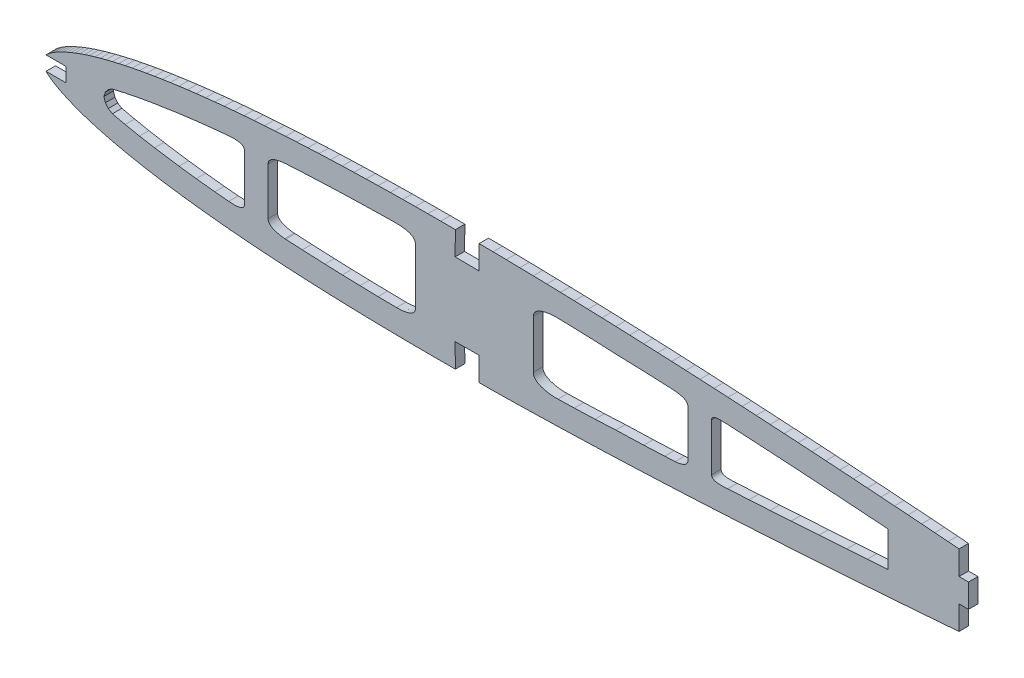
from build123d import *

# Parameters (mm, degrees)
EXTRUDE_1_DEPTH = 2


with BuildPart() as part:
    # Model → 凸台-拉伸1 (new body)
    with BuildSketch(Plane.XY):
        Polygon((191.515241736, 23.601537305), (189.189176536, 23.785656363), (186.398176536, 24.003656363), (183.607176536, 24.218656363), (180.758176536, 24.435656363), (177.909176536, 24.647656363), (175.060176536, 24.856656363), (172.163176536, 25.064656363), (169.268176536, 25.268656363), (166.371176536, 25.468656363), (163.441176536, 25.667656363), (160.511176536, 25.862656363), (157.580176536, 26.052656363), (154.625176536, 26.236656363), (151.671176536, 26.415656363), (148.716176536, 26.590656363), (145.750176536, 26.764656363), (142.786176536, 26.933656363), (139.820176536, 27.097656363), (136.855176536, 27.255656363), (133.890176536, 27.405656363), (130.924176536, 27.548656363), (127.970176536, 27.684656363), (125.015176536, 27.813656363), (122.060176536, 27.936656363), (119.130176536, 28.052656363), (116.200176536, 28.161656363), (113.269176536, 28.262656363), (110.373176536, 28.355656363), (107.477176536, 28.440656363), (104.580176536, 28.517656363), (101.731176536, 28.586656363), (98.883176536, 28.647656363), (96.033176536, 28.699656363), (93.242176536, 28.741656363), (90.28869879, 28.756656363), (90.24269879, 23.756656363), (85.24369879, 23.802656363), (85.28969879, 28.801656363), (82.213176536, 28.817656363), (79.489176536, 28.812656363), (76.845176536, 28.798656363), (74.201176536, 28.773656363), (71.557176536, 28.738656363), (69.003176536, 28.694656363), (66.450176536, 28.638656363), (63.897176536, 28.571656363), (61.442176536, 28.496656363), (58.989176536, 28.409656363), (56.535176536, 28.310656363), (54.189176536, 28.205656363), (51.845176536, 28.087656363), (49.501176536, 27.956656363), (47.274176536, 27.819656363), (45.049176536, 27.669656363), (42.824176536, 27.506656363), (40.725176536, 27.338656363), (38.627176536, 27.157656363), (36.530176536, 26.961656363), (34.565176536, 26.765656363), (32.603176536, 26.555656363), (30.641176536, 26.330656363), (28.821176536, 26.105656363), (27.002176536, 25.866656363), (25.186176536, 25.610656363), (23.516176536, 25.359656363), (21.849176536, 25.092656363), (20.184176536, 24.808656363), (18.670176536, 24.533656363), (17.160176536, 24.242656363), (15.653176536, 23.932656363), (14.301176536, 23.636656363), (12.954176536, 23.322656363), (11.612176536, 22.988656363), (10.427176536, 22.676656363), (9.248176536, 22.346656363), (8.075176536, 21.994656363), (7.062176536, 21.668656363), (6.056176536, 21.322656363), (5.060176536, 20.951656363), (4.224176536, 20.616656363), (3.396176536, 20.261656363), (2.577176536, 19.885656363), (1.918176536, 19.563656363), (1.269176536, 19.220656363), (0.636176536, 18.848656363), (0.152176536, 18.532656363), (-0.313823464, 18.192656363), (-0.757823464, 17.825656363), (-1.04236005, 17.559656363), (3.125176536, 17.559656363), (3.125176536, 14.559656363), (-1.041290363, 14.559656363), (-0.757823464, 14.294656363), (-0.313823464, 13.927656363), (0.152176536, 13.587656363), (0.636176536, 13.271656363), (1.269176536, 12.899656363), (1.918176536, 12.556656363), (2.577176536, 12.234656363), (3.396176536, 11.858656363), (4.224176536, 11.503656363), (5.060176536, 11.168656363), (6.056176536, 10.797656363), (7.062176536, 10.451656363), (8.075176536, 10.125656363), (9.248176536, 9.773656363), (10.427176536, 9.443656363), (11.612176536, 9.131656363), (12.954176536, 8.797656363), (14.301176536, 8.483656363), (15.653176536, 8.187656363), (17.160176536, 7.877656363), (18.670176536, 7.586656363), (20.184176536, 7.311656363), (21.849176536, 7.027656363), (23.516176536, 6.760656363), (25.186176536, 6.509656363), (27.002176536, 6.253656363), (28.821176536, 6.014656363), (30.641176536, 5.789656363), (32.603176536, 5.564656363), (34.565176536, 5.354656363), (36.530176536, 5.157656363), (38.627176536, 4.962656363), (40.725176536, 4.781656363), (42.824176536, 4.613656363), (45.049176536, 4.450656363), (47.274176536, 4.300656363), (49.501176536, 4.163656363), (51.845176536, 4.032656363), (54.189176536, 3.914656363), (56.535176536, 3.809656363), (58.989176536, 3.710656363), (61.442176536, 3.623656363), (63.897176536, 3.548656363), (66.450176536, 3.481656363), (69.003176536, 3.425656363), (71.557176536, 3.381656363), (74.201176536, 3.346656363), (76.845176536, 3.321656363), (79.489176536, 3.307656363), (82.213176536, 3.302656363), (85.28969879, 3.317656363), (85.24369879, 8.317656363), (90.24369879, 8.363656363), (90.28869879, 3.363656363), (93.242176536, 3.378656363), (96.033176536, 3.420656363), (98.883176536, 3.472656363), (101.731176536, 3.533656363), (104.580176536, 3.602656363), (107.477176536, 3.679656363), (110.373176536, 3.764656363), (113.269176536, 3.857656363), (116.200176536, 3.958656363), (119.130176536, 4.067656363), (122.060176536, 4.183656363), (125.015176536, 4.306656363), (127.970176536, 4.435656363), (130.924176536, 4.571656363), (133.890176536, 4.714656363), (136.855176536, 4.864656363), (139.820176536, 5.021656363), (142.786176536, 5.186656363), (145.750176536, 5.355656363), (148.716176536, 5.529656363), (151.671176536, 5.704656363), (154.625176536, 5.883656363), (157.580176536, 6.067656363), (160.511176536, 6.256656363), (163.441176536, 6.451656363), (166.371176536, 6.651656363), (169.268176536, 6.851656363), (172.163176536, 7.055656363), (175.060176536, 7.263656363), (177.909176536, 7.472656363), (180.758176536, 7.684656363), (183.607176536, 7.901656363), (186.398176536, 8.116656363), (189.189176536, 8.334656363), (191.515241736, 8.518775421), (191.515241736, 13.559656363), (193.515241736, 13.559656363), (193.515241736, 16.059656363), (193.515241736, 18.559656363), (191.515241736, 18.559656363), align=None)
        with BuildLine():
            Line((12.954176536, 18.322656363), (15.653176536, 18.932656363))
            Line((15.653176536, 18.932656363), (18.670176536, 19.533656363))
            Line((18.670176536, 19.533656363), (21.849176536, 20.092656363))
            Line((21.849176536, 20.092656363), (27.002176536, 20.866656363))
            Line((27.002176536, 20.866656363), (30.641176536, 21.330656363))
            Line((30.641176536, 21.330656363), (34.565176536, 21.765656363))
            Line((34.565176536, 21.765656363), (37.769265252, 22.068135879))
            add(Edge.make_bspline(
                [(37.769265252, 22.068135879), (38.826230169, 22.167917834), (40.790382685, 22.121320752), (40.790382685, 21.059656363)],
                knots=[0, 0, 0, 0, 3.184993167, 3.184993167, 3.184993167, 3.184993167], degree=3))
            Line((40.790382685, 21.059656363), (40.790382685, 11.059656363))
            add(Edge.make_bspline(
                [(37.494616935, 10.077104809), (38.635912601, 9.969361675), (40.790382685, 9.913286274), (40.790382685, 11.059656363)],
                knots=[0, 0, 0, 0, 3.439110268, 3.439110268, 3.439110268, 3.439110268], degree=3))
            Line((37.494616935, 10.077104809), (34.565176536, 10.353656363))
            Line((34.565176536, 10.353656363), (30.641176536, 10.788656363))
            Line((30.641176536, 10.788656363), (27.002176536, 11.252656363))
            Line((27.002176536, 11.252656363), (21.849176536, 12.026656363))
            Line((21.849176536, 12.026656363), (18.670176536, 12.585656363))
            Line((18.670176536, 12.585656363), (15.653176536, 13.186656363))
            Line((15.653176536, 13.186656363), (12.954176536, 13.796656363))
            Line((12.954176536, 13.796656363), (12.086530821, 14.317751905))
            Line((12.086530821, 14.317751905), (11.489762582, 15.087368769))
            Line((11.489762582, 15.087368769), (11.166512234, 16.059656363))
            Line((11.166512234, 16.059656363), (11.489762582, 17.031943958))
            Line((11.489762582, 17.031943958), (12.086530821, 17.801560821))
            Line((12.086530821, 17.801560821), (12.954176536, 18.322656363))
        make_face(mode=Mode.SUBTRACT)
        with BuildLine():
            Line((49.501176536, 22.956656363), (53.017176536, 23.146656363))
            Line((53.017176536, 23.146656363), (57.193014555, 23.334547073))
            Line((57.193014555, 23.334547073), (59.602176536, 23.428406363))
            Line((59.602176536, 23.428406363), (61.442176536, 23.496656363))
            Line((61.442176536, 23.496656363), (65.173676536, 23.605156363))
            Line((65.173676536, 23.605156363), (69.003176536, 23.694656363))
            Line((69.003176536, 23.694656363), (72.389708579, 23.748390037))
            add(Edge.make_bspline(
                [(72.389708579, 23.748390037), (73.983028441, 23.773671041), (76.845176536, 23.609117589), (76.845176536, 22.015597174)],
                knots=[0, 0, 0, 0, 4.780561245, 4.780561245, 4.780561245, 4.780561245], degree=3))
            Line((76.845176536, 22.015597174), (76.845176536, 10.103756363))
            add(Edge.make_bspline(
                [(72.879176536, 8.363156363), (74.322710889, 8.340251987), (76.845176536, 8.660040311), (76.845176536, 10.103756363)],
                knots=[0, 0, 0, 0, 4.331148157, 4.331148157, 4.331148157, 4.331148157], degree=3))
            Line((72.879176536, 8.363156363), (69.003176536, 8.424656363))
            Line((69.003176536, 8.424656363), (65.173676536, 8.514156363))
            Line((65.173676536, 8.514156363), (61.442176536, 8.622656363))
            Line((61.442176536, 8.622656363), (57.762176536, 8.759156363))
            Line((57.762176536, 8.759156363), (53.017176536, 8.972656363))
            Line((53.017176536, 8.972656363), (49.501176536, 9.162656363))
            Line((49.501176536, 9.162656363), (49.29982931, 9.175636294))
            add(Edge.make_bspline(
                [(49.29982931, 9.175636294), (47.974851934, 9.261051503), (45.790382685, 9.731928679), (45.790382685, 11.059656363)],
                knots=[0, 0, 0, 0, 3.983183053, 3.983183053, 3.983183053, 3.983183053], degree=3))
            Line((45.790382685, 11.059656363), (45.790382685, 21.059656363))
            add(Edge.make_bspline(
                [(49.501176536, 22.956656363), (48.114012031, 22.881695824), (45.790382685, 22.448844776), (45.790382685, 21.059656363)],
                knots=[0, 0, 0, 0, 4.167565237, 4.167565237, 4.167565237, 4.167565237], degree=3))
        make_face(mode=Mode.SUBTRACT)
        with BuildLine():
            Line((106.879260412, 23.454977031), (110.373176536, 23.355656363))
            Line((110.373176536, 23.355656363), (113.577577803, 23.250226676))
            Line((113.577577803, 23.250226676), (116.158492169, 23.141702513))
            Line((116.158492169, 23.141702513), (119.130176536, 22.994656363))
            Line((119.130176536, 22.994656363), (125.015176536, 22.813656363))
            Line((125.015176536, 22.813656363), (129.447176536, 22.616656363))
            Line((129.447176536, 22.616656363), (131.165680228, 22.533711117))
            add(Edge.make_bspline(
                [(131.165680228, 22.533711117), (132.326479999, 22.477683991), (134.325192675, 22.221807449), (134.325192675, 21.059656363)],
                knots=[0, 0, 0, 0, 3.486453258, 3.486453258, 3.486453258, 3.486453258], degree=3))
            Line((134.325192675, 21.059656363), (134.325192675, 11.059656363))
            add(Edge.make_bspline(
                [(131.638233986, 9.608409874), (132.654992905, 9.657484729), (134.325192675, 10.04171381), (134.325192675, 11.059656363)],
                knots=[0, 0, 0, 0, 3.053827658, 3.053827658, 3.053827658, 3.053827658], degree=3))
            Line((131.638233986, 9.608409874), (129.447176536, 9.502656363))
            Line((129.447176536, 9.502656363), (125.015176536, 9.305656363))
            Line((125.015176536, 9.305656363), (119.130176536, 9.124656363))
            Line((119.130176536, 9.124656363), (114.734676536, 8.907156363))
            Line((114.734676536, 8.907156363), (110.373176536, 8.763656363))
            Line((110.373176536, 8.763656363), (106.913662904, 8.665313646))
            add(Edge.make_bspline(
                [(101.730340979, 10.965832209), (101.730340979, 9.075529122), (105.024123113, 8.611600178), (106.913662904, 8.665313646)],
                knots=[0, 0, 0, 0, 5.67090926, 5.67090926, 5.67090926, 5.67090926], degree=3))
            Line((101.730340979, 10.965832209), (101.730340979, 21.153480517))
            add(Edge.make_bspline(
                [(106.879260412, 23.454977031), (105.000059202, 23.508396607), (101.730340979, 23.033440846), (101.730340979, 21.153480517)],
                knots=[0, 0, 0, 0, 5.639880985, 5.639880985, 5.639880985, 5.639880985], degree=3))
        make_face(mode=Mode.SUBTRACT)
        with BuildLine():
            Line((142.59839192, 21.94183127), (147.233176536, 21.677656363))
            Line((147.233176536, 21.677656363), (151.671176536, 21.415656363))
            Line((151.671176536, 21.415656363), (156.102676536, 21.144656363))
            Line((156.102676536, 21.144656363), (161.976176536, 20.765156363))
            Line((161.976176536, 20.765156363), (167.819676536, 20.368656363))
            Line((167.819676536, 20.368656363), (172.163176536, 20.064656363))
            Line((172.163176536, 20.064656363), (176.484676536, 19.752156363))
            Line((176.484676536, 19.752156363), (176.484676536, 12.367156363))
            Line((176.484676536, 12.367156363), (172.163176536, 12.054656363))
            Line((172.163176536, 12.054656363), (167.819676536, 11.750656363))
            Line((167.819676536, 11.750656363), (161.976176536, 11.354156363))
            Line((161.976176536, 11.354156363), (156.102676536, 10.974656363))
            Line((156.102676536, 10.974656363), (151.671176536, 10.703656363))
            Line((151.671176536, 10.703656363), (147.233176536, 10.441656363))
            Line((147.233176536, 10.441656363), (142.712343677, 10.183976514))
            add(Edge.make_bspline(
                [(139.325192675, 11.059656363), (139.325192675, 9.893484701), (141.548061745, 10.117614407), (142.712343677, 10.183976514)],
                knots=[0, 0, 0, 0, 3.498514987, 3.498514987, 3.498514987, 3.498514987], degree=3))
            Line((139.325192675, 11.059656363), (139.325192675, 21.059656363))
            add(Edge.make_bspline(
                [(139.325192675, 21.059656363), (139.325192675, 22.189654685), (141.470224711, 22.006134899), (142.59839192, 21.94183127)],
                knots=[0, 0, 0, 0, 3.389994965, 3.389994965, 3.389994965, 3.389994965], degree=3))
        make_face(mode=Mode.SUBTRACT)
    extrude(amount=EXTRUDE_1_DEPTH)


solid = part.part
